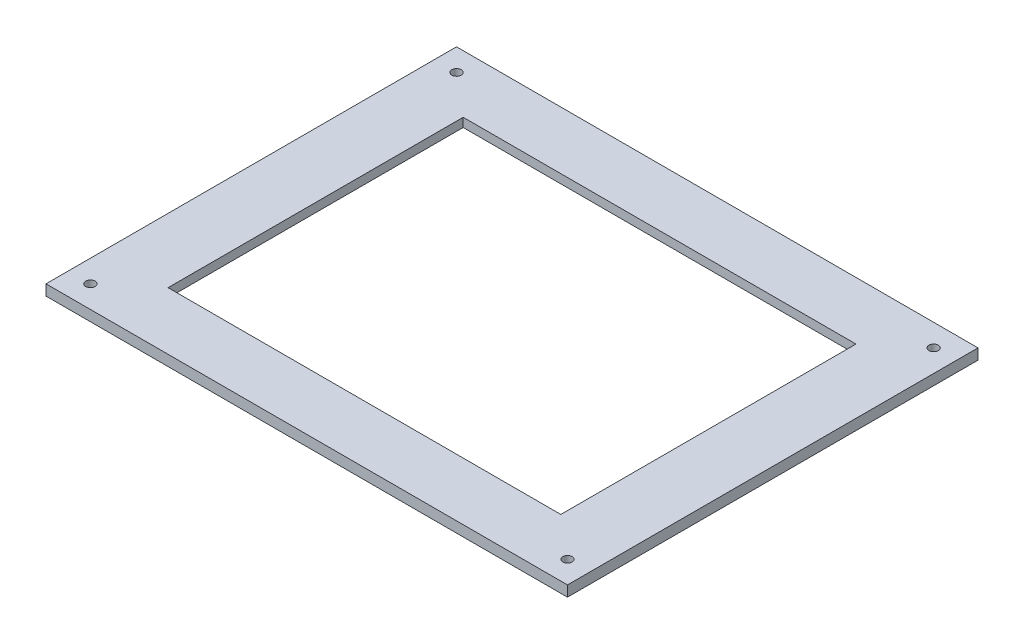
from build123d import *

# Parameters (mm, degrees)
CROQUIS1_W              = 235
CROQUIS1_H              = 185
CROQUIS1_W_2            = 177
CROQUIS1_H_2            = 133
SALIENTE_EXTRUIR1_DEPTH = 4
CROQUIS2_W              = 235
CROQUIS2_H              = 185
CROQUIS2_W_2            = 188
CROQUIS2_H_2            = 142
SALIENTE_EXTRUIR2_DEPTH = 0.8
CROQUIS3_R              = 2.125
CORTAR_EXTRUIR1_DEPTH   = 5
CROQUIS4_W              = 12
CROQUIS4_H              = 11
CORTAR_EXTRUIR2_DEPTH   = 1.2


with BuildPart() as part:
    # Croquis1 → Saliente-Extruir1 (new body)
    with BuildSketch(Plane(origin=(0, 0, 0), x_dir=(1, 0, 0), z_dir=(0, 1, 0))):
        Rectangle(CROQUIS1_W, CROQUIS1_H)
        Rectangle(CROQUIS1_W_2, CROQUIS1_H_2, mode=Mode.SUBTRACT)
    extrude(amount=SALIENTE_EXTRUIR1_DEPTH)

    # Croquis2 → Saliente-Extruir2 (add)
    with BuildSketch(Plane.XZ):
        Rectangle(CROQUIS2_W, CROQUIS2_H)
        Rectangle(CROQUIS2_W_2, CROQUIS2_H_2, mode=Mode.SUBTRACT)
    extrude(amount=SALIENTE_EXTRUIR2_DEPTH)

    # Croquis3 → Cortar-Extruir1 (cut)
    with BuildSketch(Plane(origin=(0, 4, 0), x_dir=(1, 0, 0), z_dir=(0, 1, 0))):
        with Locations(Location((-107.5, 82.5, 0), (0, 0, 270))):
            Circle(CROQUIS3_R)
        with Locations(Location((-107.5, -82.5, 0), (0, 0, 270))):
            Circle(CROQUIS3_R)
        with Locations(Location((107.5, 82.5, 0), (0, 0, 270))):
            Circle(CROQUIS3_R)
        with Locations(Location((107.5, -82.5, 0), (0, 0, 270))):
            Circle(CROQUIS3_R)
    extrude(amount=-CORTAR_EXTRUIR1_DEPTH, mode=Mode.SUBTRACT)

    # Croquis4 → Cortar-Extruir2 (cut)
    with BuildSketch(Plane.XZ.offset(0.8)):
        with Locations((-100, 5.5)):
            Rectangle(CROQUIS4_W, CROQUIS4_H)
        with Locations((-100, -5.5)):
            Rectangle(CROQUIS4_W, CROQUIS4_H)
        with Locations((100, 5.5)):
            Rectangle(CROQUIS4_W, CROQUIS4_H)
        with Locations((100, -5.5)):
            Rectangle(CROQUIS4_W, CROQUIS4_H)
    extrude(amount=-CORTAR_EXTRUIR2_DEPTH, mode=Mode.SUBTRACT)


solid = part.part
